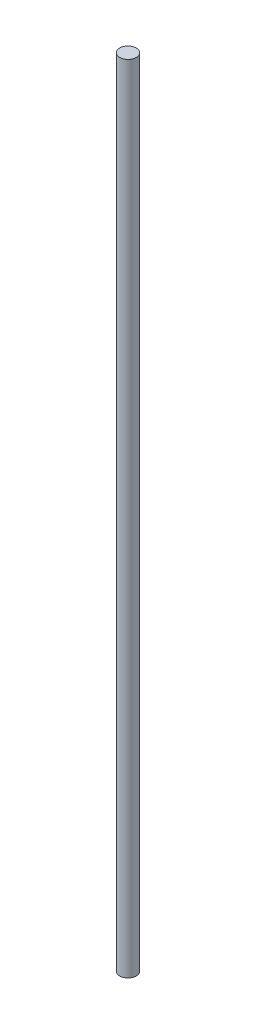
from build123d import *

# Parameters (mm, degrees)
SKETCH1_R           = 4
BOSS_EXTRUDE1_DEPTH = 386.26


with BuildPart() as part:
    # Sketch1 → Boss-Extrude1 (new body)
    with BuildSketch(Plane(origin=(0, 0, 0), x_dir=(1, 0, 0), z_dir=(0, 1, 0))):
        with Locations(Location((0, 0, 0), (0, 0, 270))):
            Circle(SKETCH1_R)
    extrude(amount=BOSS_EXTRUDE1_DEPTH)


solid = part.part
